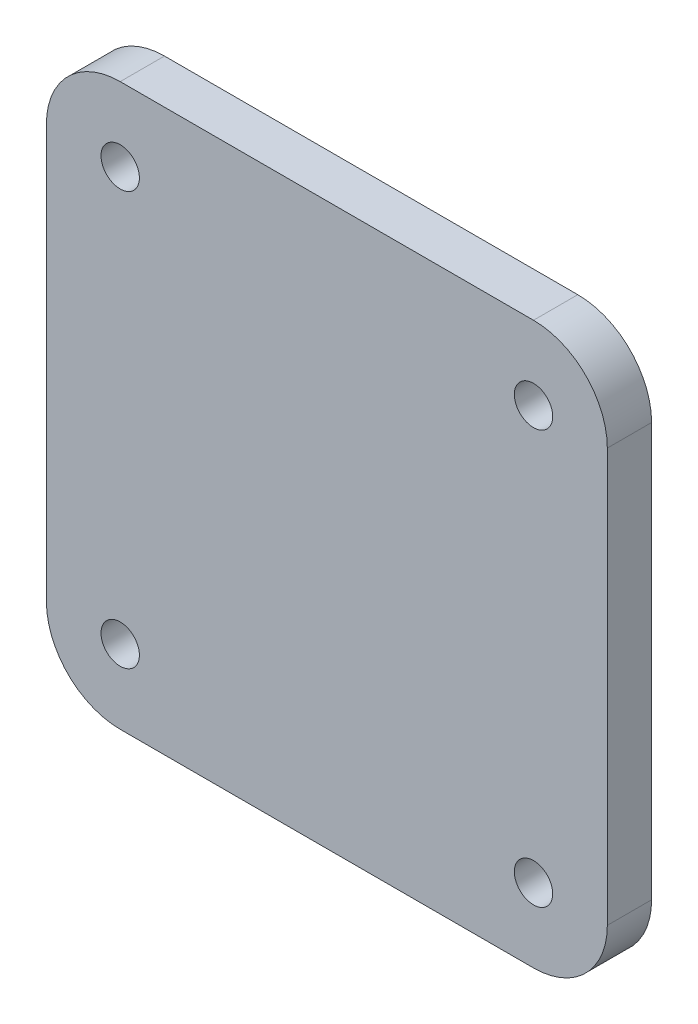
from build123d import *

# Parameters (mm, degrees)
SKETCH_1_W      = 38
SKETCH_1_H      = 38
SKETCH_1_R      = 1.3
EXTRUDE_1_DEPTH = 3
FILLET_1_R      = 5


with BuildPart() as part:
    # 草图1 → 凸台-拉伸1 (new body)
    with BuildSketch(Plane.XY):
        Rectangle(SKETCH_1_W, SKETCH_1_H)
        with Locations((-14, -14)):
            Circle(SKETCH_1_R, mode=Mode.SUBTRACT)
        with Locations((14, -14)):
            Circle(SKETCH_1_R, mode=Mode.SUBTRACT)
        with Locations((14, 14)):
            Circle(SKETCH_1_R, mode=Mode.SUBTRACT)
        with Locations((-14, 14)):
            Circle(SKETCH_1_R, mode=Mode.SUBTRACT)
    extrude(amount=EXTRUDE_1_DEPTH)

    # 圆角1
    fillet_1_edges = [part.edges().sort_by_distance(p)[0] for p in [
        (19, -19, 1.5),
        (-19, -19, 1.5),
        (-19, 19, 1.5),
        (19, 19, 1.5),
    ]]
    fillet(fillet_1_edges, radius=FILLET_1_R)


solid = part.part
